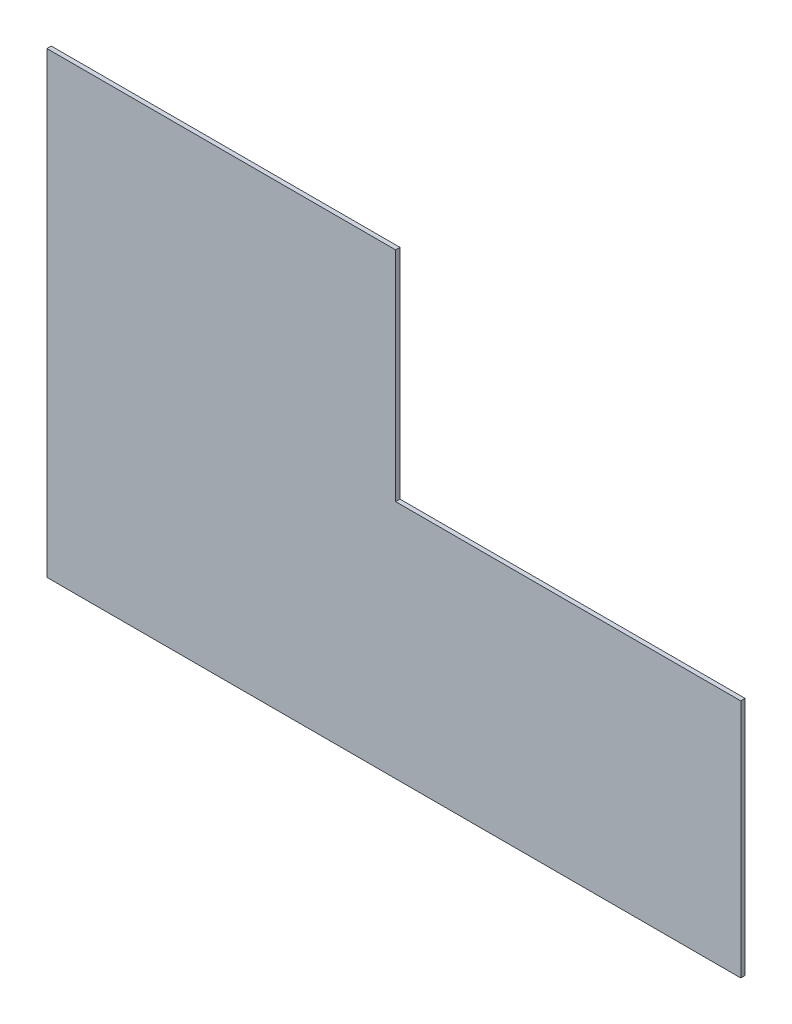
from build123d import *

# Parameters (mm, degrees)
BOSS_EXTRUDE1_DEPTH = 3


with BuildPart() as part:
    # Sketch1 → Boss-Extrude1 (new body)
    with BuildSketch(Plane.XY):
        Polygon((0, 0), (479.5, 0), (479.5, 165.84), (241, 165.84), (241, 316.5), (0, 316.5), align=None)
    extrude(amount=BOSS_EXTRUDE1_DEPTH)


solid = part.part
